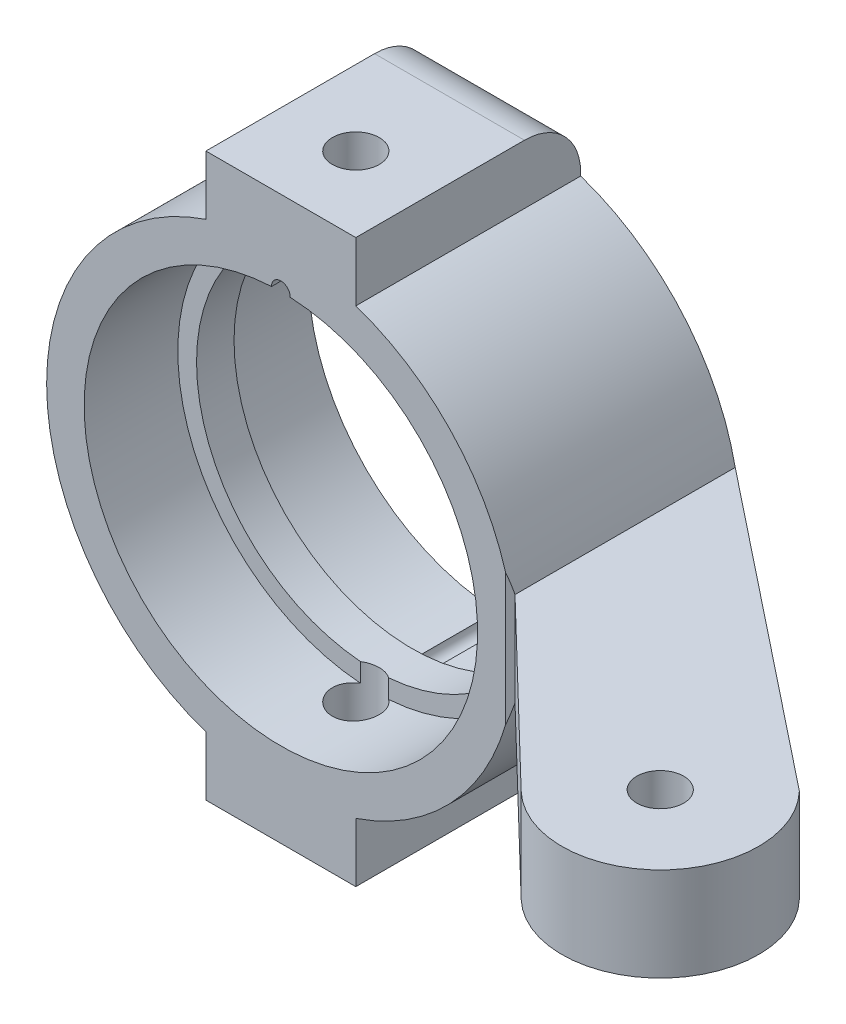
from build123d import *
from build123d.topology import SkipClean

# Parameters (mm, degrees)
SKETCH1_R                = 12.5
SKETCH1_R_2              = 9.5
BOSS_EXTRUDE1_DEPTH      = 7
SKETCH2_R                = 12.5
SKETCH2_R_2              = 9.5
BOSS_EXTRUDE2_DEPTH      = 5
BOSS_EXTRUDE3_DEPTH      = 15
BOSS_EXTRUDE3_DEPTH_BACK = 15
SKETCH3_W                = 8
SKETCH3_H                = 12
FILLET1_R                = 3
SKETCH6_R                = 1.25
CUT_EXTRUDE3_DEPTH       = 35.644624403
SKETCH7_W                = 10
SKETCH7_H                = 5
BOSS_EXTRUDE4_DEPTH      = 16
CHAMFER1_SIZE            = 8
SKETCH8_W                = 10.963763172
SKETCH8_H                = 5
BOSS_EXTRUDE5_DEPTH      = 18
SKETCH9_R                = 1.25
CUT_EXTRUDE4_DEPTH       = 45.459649771
BOSS_EXTRUDE7_DEPTH      = 5
SKETCH12_R               = 10.525
CUT_EXTRUDE7_DEPTH       = 5
SKETCH4_R                = 9.5
CUT_EXTRUDE8_DEPTH       = 36.951519181
SKETCH14_R               = 0.5
CUT_EXTRUDE9_DEPTH       = 5
CUT_EXTRUDE10_DEPTH      = 5
CUT_EXTRUDE12_DEPTH      = 5


with BuildPart() as part:
    # Sketch1 → Boss-Extrude1 (new body)
    with BuildSketch(Plane.XY):
        Circle(SKETCH1_R)
        Circle(SKETCH1_R_2, mode=Mode.SUBTRACT)
    extrude(amount=BOSS_EXTRUDE1_DEPTH)

    # Sketch2 → Boss-Extrude2 (add)
    with BuildSketch(Plane.XY.offset(7)):
        Circle(SKETCH2_R)
        Circle(SKETCH2_R_2, mode=Mode.SUBTRACT)
    extrude(amount=BOSS_EXTRUDE2_DEPTH)

    # Sketch3 → Boss-Extrude3 (add, two sides: drawn at the far end of the back side and taken through both)
    with BuildSketch(Plane(origin=(0, 0, 0), x_dir=(1, 0, 0), z_dir=(0, 1, 0)).offset(-BOSS_EXTRUDE3_DEPTH_BACK)):
        with Locations((0, -6)):
            Rectangle(SKETCH3_W, SKETCH3_H)
    extrude(amount=BOSS_EXTRUDE3_DEPTH + BOSS_EXTRUDE3_DEPTH_BACK)

    # Fillet1
    fillet1_edges = [part.edges().sort_by_distance(p)[0] for p in [
        (0, -15, 0),
        (0, 15, 0),
    ]]
    fillet(fillet1_edges, radius=FILLET1_R)

    # Sketch6 → Cut-Extrude3 (cut, through all)
    with BuildSketch(Plane(origin=(0, 15, 0), x_dir=(1, 0, 0), z_dir=(0, 1, 0))):
        with Locations((0, -8)):
            Circle(SKETCH6_R)
    extrude(amount=-CUT_EXTRUDE3_DEPTH, mode=Mode.SUBTRACT)

    # Sketch7 → Boss-Extrude4 (add)
    with BuildSketch(Plane(origin=(4, 0, 0), x_dir=(0, 0, -1), z_dir=(1, 0, 0))):
        with Locations((-7, 0)):
            Rectangle(SKETCH7_W, SKETCH7_H)
    extrude(amount=BOSS_EXTRUDE4_DEPTH)

    # Chamfer1
    chamfer1_edges = [part.edges().sort_by_distance(p)[0] for p in [
        (20, 0, 12),
    ]]
    chamfer(chamfer1_edges, length=CHAMFER1_SIZE)

    # Sketch8 → Boss-Extrude5 (add)
    with BuildSketch(Plane(origin=(12, 0, 12), x_dir=(0.7071067811865487, 0, -0.7071067811865465), z_dir=(0.7071067811865465, 0, 0.7071067811865487))):
        with Locations((5.831826913, 0)):
            Rectangle(SKETCH8_W, SKETCH8_H)
    extrude(amount=BOSS_EXTRUDE5_DEPTH)

    # Sketch9 → Cut-Extrude4 (cut, through all)
    with BuildSketch(Plane(origin=(0, 2.5, 0), x_dir=(1, 0, 0), z_dir=(0, 1, 0))):
        Polygon((18.071186966, -2), (20, -4), (20, -2), align=None)
        with BuildLine():
            Line((20, -4), (28.918290257, -13.247438813))
            ThreePointArc((28.918290257, -13.247438813), (30.389120415, -16.93944416), (28.851646418, -20.604197704))
            Line((28.851646418, -20.604197704), (32.727922061, -16.727922061))
            Line((32.727922061, -16.727922061), (20, -4))
        make_face()
        with BuildLine():
            ThreePointArc((28.851646418, -20.604197704), (25.186892874, -22.141671701), (21.494887527, -20.670841544))
            Line((21.494887527, -20.670841544), (12.247448714, -11.752551286))
            Line((12.247448714, -11.752551286), (24.975370775, -24.480473347))
            Line((24.975370775, -24.480473347), (28.851646418, -20.604197704))
        make_face()
        with Locations((25.139335817, -16.891887103)):
            Circle(SKETCH9_R)
    extrude(amount=-CUT_EXTRUDE4_DEPTH, mode=Mode.SUBTRACT)

    # Sketch10 → Boss-Extrude7 (add)
    with BuildSketch(Plane(origin=(0, 2.5, 0), x_dir=(1, 0, 0), z_dir=(0, 1, 0))):
        Polygon((12.247448714, -2), (12.247448714, 0), (18.071186966, -2), align=None)
    extrude(amount=-BOSS_EXTRUDE7_DEPTH)

    # Sketch12 → Cut-Extrude7 (cut)
    with BuildSketch(Plane(origin=(0, 0, 0), x_dir=(-1, 0, 0), z_dir=(0, 0, -1))):
        Circle(SKETCH12_R)
    extrude(amount=-CUT_EXTRUDE7_DEPTH, mode=Mode.SUBTRACT)

    # Sketch4 → Cut-Extrude8 (cut, through all)
    with SkipClean():  # the faces are left unmerged after this step: merging them gives an invalid solid
        with BuildSketch(Plane.XY.offset(12)):
            Circle(SKETCH4_R)
        extrude(amount=-CUT_EXTRUDE8_DEPTH, mode=Mode.SUBTRACT)

    # Sketch14 → Cut-Extrude9 (cut)
    with SkipClean():  # the faces are left unmerged after this step: merging them gives an invalid solid
        with BuildSketch(Plane(origin=(0, 0, 0), x_dir=(-1, 0, 0), z_dir=(0, 0, -1))):
            with Locations((0, 10.525)):
                Circle(SKETCH14_R)
            with Locations((0, -10.525)):
                Circle(SKETCH14_R)
        extrude(amount=-CUT_EXTRUDE9_DEPTH, mode=Mode.SUBTRACT)

    # Sketch15 → Cut-Extrude10 (cut)
    with SkipClean():  # the faces are left unmerged after this step: merging them gives an invalid solid
        with BuildSketch(Plane.XY.offset(12)):
            with BuildLine():
                ThreePointArc((-0.499858257, 10.488095238), (0, -10.5), (0.499858257, 10.488095238))
                ThreePointArc((0.499858257, 10.488095238), (0, 11), (-0.499858257, 10.488095238))
            make_face()
        extrude(amount=-CUT_EXTRUDE10_DEPTH, mode=Mode.SUBTRACT)

    # Sketch16 → Cut-Extrude12 (cut)
    with SkipClean():  # the faces are left unmerged after this step: merging them gives an invalid solid
        with BuildSketch(Plane(origin=(0, 2.5, 0), x_dir=(1, 0, 0), z_dir=(0, 1, 0))):
            Polygon((12.247448714, 0), (28.918290257, -13.247438813), (18.071186966, -2), align=None)
        extrude(amount=-CUT_EXTRUDE12_DEPTH, mode=Mode.SUBTRACT)


solid = part.part
